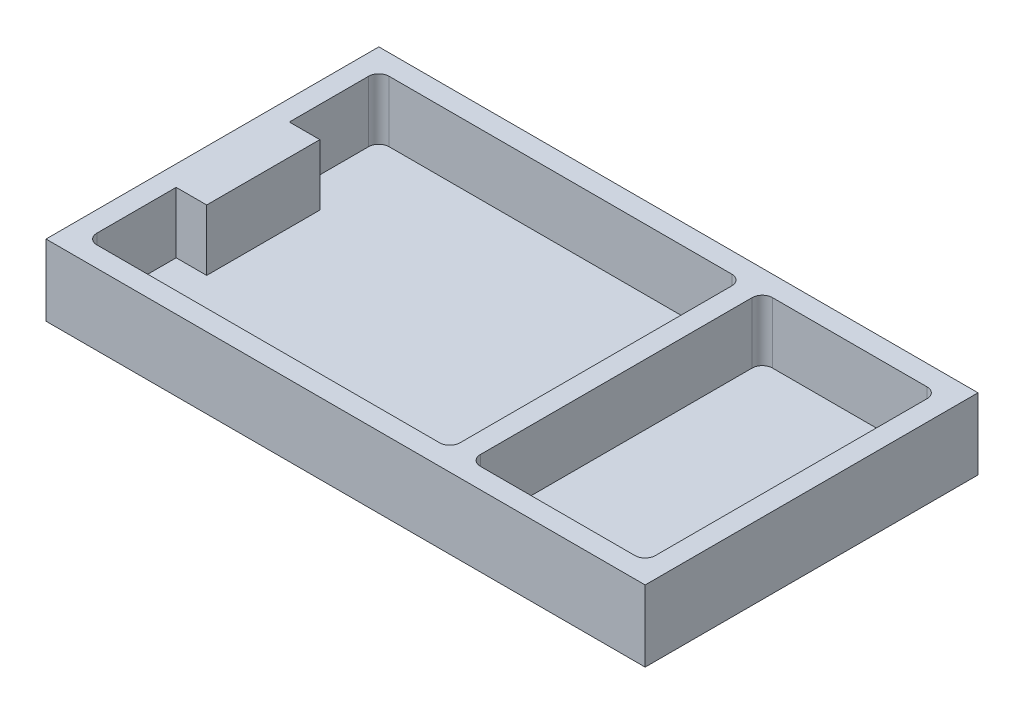
from build123d import *

# Parameters (mm, degrees)
SKETCH11_W     = 187.05178758
SKETCH11_H     = 103.91050065
EXTRUDE3_DEPTH = 19.05
SKETCH12_W     = 187.05178758
SKETCH12_H     = 103.91050065
EXTRUDE4_DEPTH = 3.175
SKETCH15_W     = 35.329261405
SKETCH15_H     = 19.05
EXTRUDE6_DEPTH = 9.525


with BuildPart() as part:
    # Sketch11 → Extrude3 (new body)
    with BuildSketch(Plane(origin=(0, 0, 0), x_dir=(1, 0, 0), z_dir=(0, 1, 0))):
        with Locations((93.52589379, 51.955250325)):
            Rectangle(SKETCH11_W, SKETCH11_H)
        with BuildLine():
            Line((9.525, 6.35), (116.541319734, 6.35))
            ThreePointArc((116.541319734, 6.35), (118.786383764, 7.27993597), (119.716319734, 9.525))
            Line((119.716319734, 9.525), (119.716319734, 94.38550065))
            ThreePointArc((119.716319734, 94.38550065), (118.786383764, 96.63056468), (116.541319734, 97.56050065))
            Line((116.541319734, 97.56050065), (9.525, 97.56050065))
            ThreePointArc((9.525, 97.56050065), (7.27993597, 96.63056468), (6.35, 94.38550065))
            Line((6.35, 94.38550065), (6.35, 9.525))
            ThreePointArc((6.35, 9.525), (7.27993597, 7.27993597), (9.525, 6.35))
        make_face(mode=Mode.SUBTRACT)
        with BuildLine():
            Line((180.70178758, 9.525), (180.70178758, 94.38550065))
            ThreePointArc((180.70178758, 94.38550065), (179.77185161, 96.63056468), (177.52678758, 97.56050065))
            Line((177.52678758, 97.56050065), (129.241319734, 97.56050065))
            ThreePointArc((129.241319734, 97.56050065), (126.996255703, 96.63056468), (126.066319734, 94.38550065))
            Line((126.066319734, 94.38550065), (126.066319734, 9.525))
            ThreePointArc((126.066319734, 9.525), (126.996255703, 7.27993597), (129.241319734, 6.35))
            Line((129.241319734, 6.35), (177.52678758, 6.35))
            ThreePointArc((177.52678758, 6.35), (179.77185161, 7.27993597), (180.70178758, 9.525))
        make_face(mode=Mode.SUBTRACT)
    extrude(amount=EXTRUDE3_DEPTH)

    # Sketch12 → Extrude4 (add)
    with BuildSketch(Plane(origin=(0, 0, 0), x_dir=(1, 0, 0), z_dir=(0, 1, 0))):
        with Locations((93.52589379, 51.955250325)):
            Rectangle(SKETCH12_W, SKETCH12_H)
    extrude(amount=-EXTRUDE4_DEPTH)

    # Sketch15 → Extrude6 (add)
    with BuildSketch(Plane(origin=(6.35, 0, 0), x_dir=(0, 0, -1), z_dir=(1, 0, 0))):
        with Locations((51.955250324, 9.525)):
            Rectangle(SKETCH15_W, SKETCH15_H)
    extrude(amount=EXTRUDE6_DEPTH)


solid = part.part
